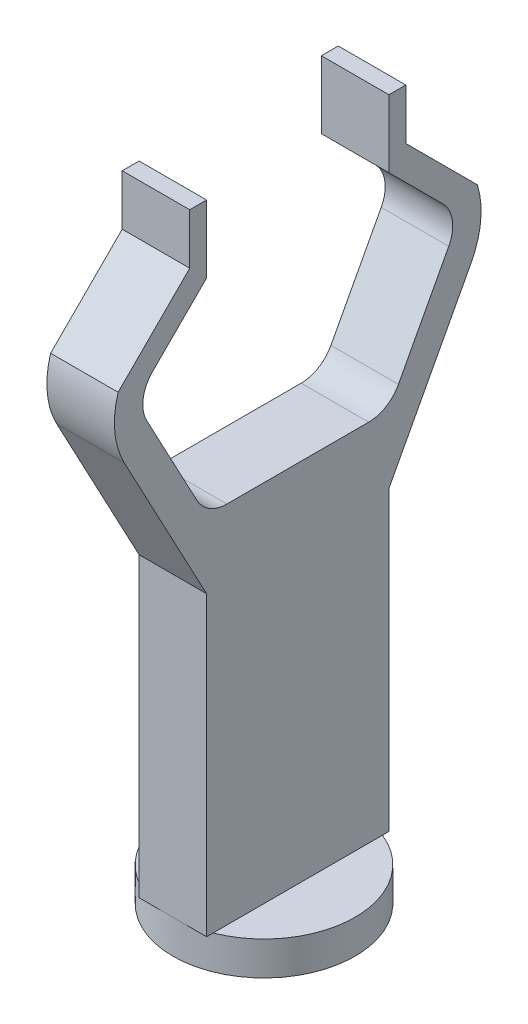
from build123d import *

# Parameters (mm, degrees)
SKETCH2_R           = 27
BOSS_EXTRUDE1_DEPTH = 10
BOSS_EXTRUDE2_DEPTH = 10
FILLET1_R           = 10


with BuildPart() as part:
    # Sketch2 → Boss-Extrude1 (new body)
    with BuildSketch(Plane(origin=(0, 0, 0), x_dir=(1, 0, 0), z_dir=(0, 1, 0))):
        with Locations(Location((0, 0, 0), (0, 0, 270))):
            Circle(SKETCH2_R)
    extrude(amount=BOSS_EXTRUDE1_DEPTH)

    # Sketch3 → Boss-Extrude2 (add, symmetric)
    with BuildSketch(Plane(origin=(0, 0, 0), x_dir=(0, 0, -1), z_dir=(1, 0, 0))):
        with BuildLine():
            Line((27, 10), (-27, 10))
            Line((-27, 10), (-27, 98))
            Line((-27, 98), (-51.368939129, 143.705592112))
            ThreePointArc((-51.368939129, 143.705592112), (-54.192675617, 153.062397712), (-53.213203436, 162.786796564))
            Line((-53.213203436, 162.786796564), (-32, 184))
            Line((-32, 184), (-32, 199))
            Line((-32, 199), (-27, 199))
            Line((-27, 199), (-27, 179))
            Line((-27, 179), (-48.213203436, 157.786796564))
            Line((-48.213203436, 157.786796564), (-27, 118))
            Line((-27, 118), (27, 118))
            Line((27, 118), (48.213203436, 157.786796564))
            Line((48.213203436, 157.786796564), (27, 179))
            Line((27, 179), (27, 199))
            Line((27, 199), (32, 199))
            Line((32, 199), (32, 184))
            Line((32, 184), (53.213203436, 162.786796564))
            ThreePointArc((53.213203436, 162.786796564), (54.192675617, 153.062397712), (51.368939129, 143.705592112))
            Line((51.368939129, 143.705592112), (27, 98))
            Line((27, 98), (27, 10))
        make_face()
    extrude(amount=BOSS_EXTRUDE2_DEPTH, both=True)

    # Fillet1
    fillet1_edges = [part.edges().sort_by_distance(p)[0] for p in [
        (0, 157.786796564, -48.213203436),
        (0, 118, -27),
        (0, 118, 27),
        (0, 157.786796564, 48.213203436),
    ]]
    fillet(fillet1_edges, radius=FILLET1_R)


solid = part.part
